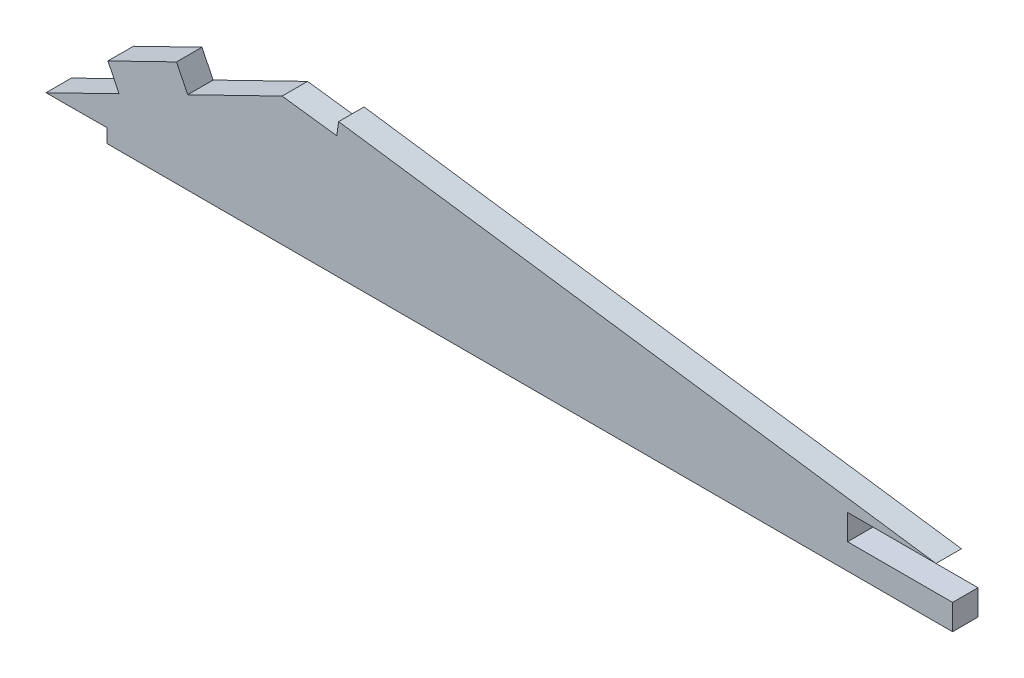
from build123d import *

# Parameters (mm, degrees)
EXTRUDE_1_DEPTH = 2


with BuildPart() as part:
    # Model → 凸台-拉伸1 (new body)
    with BuildSketch(Plane.XY):
        Polygon((7.755986118, 7.193996024), (6.879243825, 8.991584116), (12.272008103, 11.621810997), (13.148750396, 9.824222904), (20.572631643, 13.445091722), (24.866857266, 12.889640288), (25.015067319, 13.927332545), (71.976286032, 7.327363669), (65.021947956, 7.327363669), (65.021947956, 5.327363669), (73.278124352, 5.327363669), (73.278124352, 3.327363669), (6.796653877, 3.327363669), (6.792450252, 4.410527762), (2.010984454, 4.39197149), align=None)
    extrude(amount=EXTRUDE_1_DEPTH)


solid = part.part
